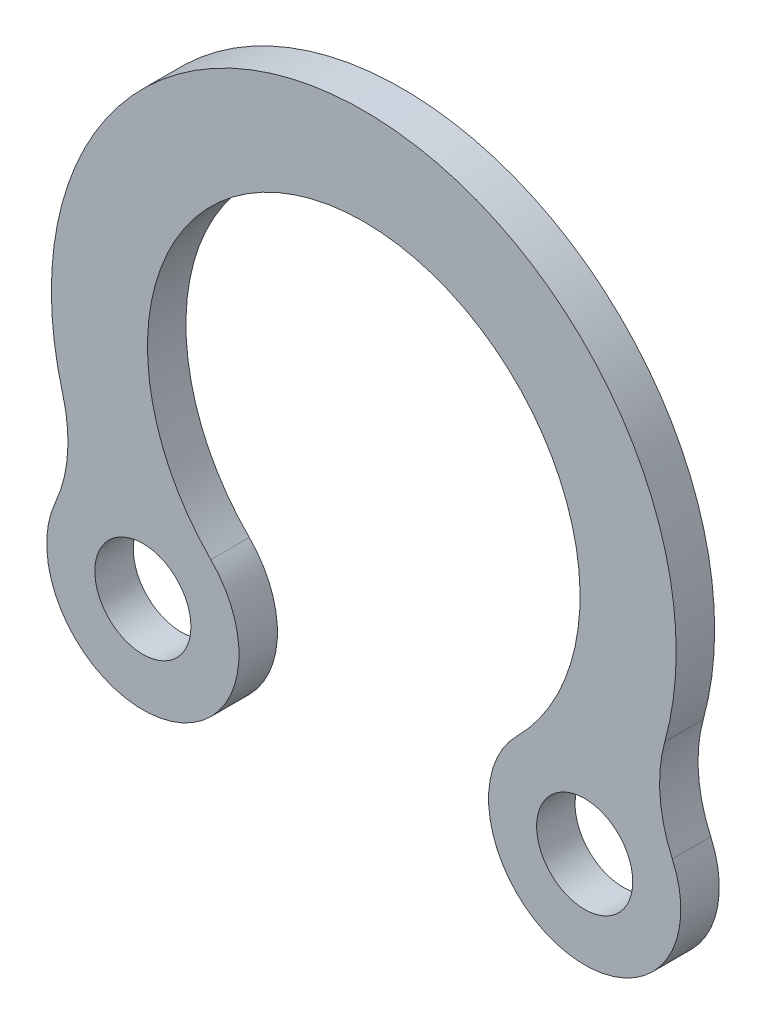
from build123d import *
from build123d.topology import SkipClean

# Parameters (mm, degrees)
SKETCH1_R           = 6.5
SKETCH1_R_2         = 4.5
BOSS_EXTRUDE1_DEPTH = 0.8
SKETCH2_R           = 2
BOSS_EXTRUDE2_DEPTH = 0.8
CUT_EXTRUDE1_START  = -0.8
CUT_EXTRUDE1_DEPTH  = 0.8
SKETCH4_R           = 1
CUT_EXTRUDE2_DEPTH  = 0.8
FILLET1_R           = 3


with BuildPart() as part:
    # Sketch1 → Boss-Extrude1 (new body)
    with BuildSketch(Plane.XY):
        Circle(SKETCH1_R)
        Circle(SKETCH1_R_2, mode=Mode.SUBTRACT)
    extrude(amount=BOSS_EXTRUDE1_DEPTH)

    # Sketch2 → Boss-Extrude2 (add)
    with BuildSketch(Plane.XY.offset(0.8)):
        with Locations((-4.596194078, -4.596194078)):
            Circle(SKETCH2_R)
        with Locations((4.596194078, -4.596194078)):
            Circle(SKETCH2_R)
    extrude(amount=-BOSS_EXTRUDE2_DEPTH)

    # Sketch3 → Cut-Extrude1 (cut)
    with SkipClean():  # the faces are left unmerged after this step: merging them gives an invalid solid
        with BuildSketch(Plane.XY.offset(0.8).offset(CUT_EXTRUDE1_START)):
            with BuildLine():
                ThreePointArc((-2.981245674, -5.775999847), (-2.602155556, -4.441887978), (-3.181980515, -3.181980515))
                ThreePointArc((-3.181980515, -3.181980515), (0, -4.5), (3.181980515, -3.181980515))
                ThreePointArc((3.181980515, -3.181980515), (2.602155556, -4.441887978), (2.981245674, -5.775999847))
                ThreePointArc((2.981245674, -5.775999847), (0, -6.5), (-2.981245674, -5.775999847))
            make_face()
        extrude(amount=CUT_EXTRUDE1_DEPTH, mode=Mode.SUBTRACT)

    # Sketch4 → Cut-Extrude2 (cut)
    with SkipClean():  # the faces are left unmerged after this step: merging them gives an invalid solid
        with BuildSketch(Plane.XY.offset(0.8)):
            with Locations((-4.596194078, -4.596194078)):
                Circle(SKETCH4_R)
            with Locations((4.596194078, -4.596194078)):
                Circle(SKETCH4_R)
        extrude(amount=-CUT_EXTRUDE2_DEPTH, mode=Mode.SUBTRACT)

    # Fillet1
    fillet1_edges = [part.edges().sort_by_distance(p)[0] for p in [
        (-5.775999847, -2.981245674, 0.4),
        (5.775999847, -2.981245674, 0.4),
    ]]
    fillet(fillet1_edges, radius=FILLET1_R)


solid = part.part
